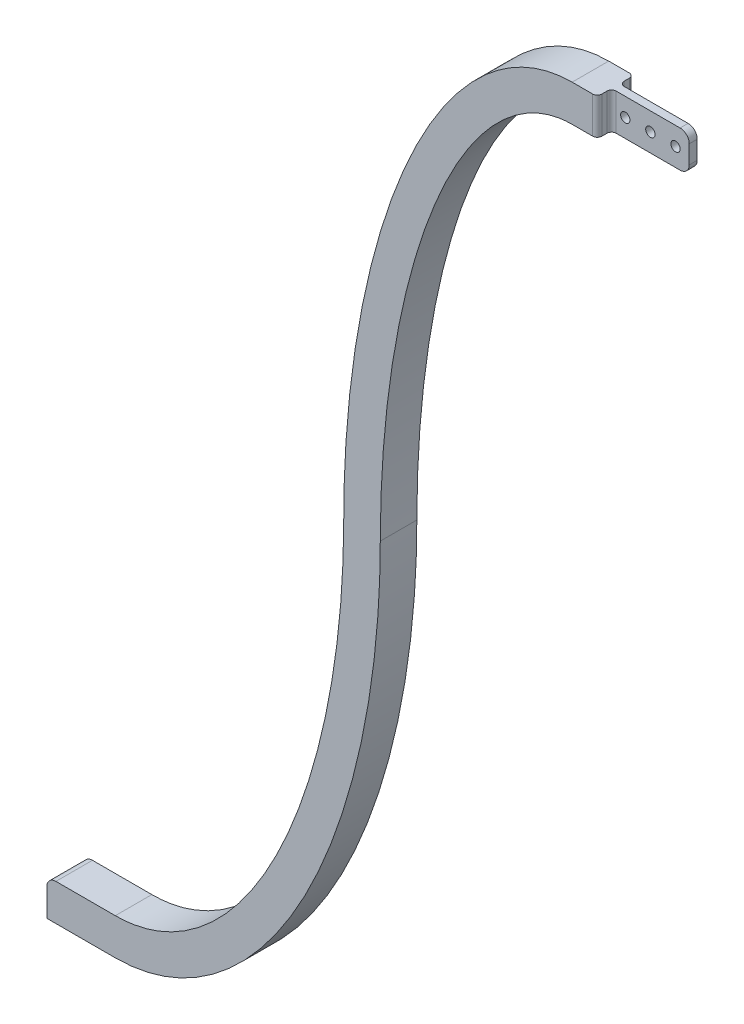
from build123d import *

# Parameters (mm, degrees)
BOSS_EXTRUDE1_DEPTH = 4
SKETCH2_R           = 1.025
CUT_EXTRUDE1_DEPTH  = 131.32363576
FILLET1_R           = 2
SKETCH3_W           = 17
SKETCH3_H           = 8
CUT_EXTRUDE2_DEPTH  = 3.125
FILLET7_R           = 1


with BuildPart() as part:
    # Sketch1 → Boss-Extrude1 (new, symmetric)
    with BuildSketch(Plane.XY):
        with BuildLine():
            add(Edge.make_bspline(
                [(-50, -100), (0, -100), (0, 0)],
                knots=[3.141592654, 3.141592654, 3.141592654, 4.71238898, 4.71238898, 4.71238898], degree=2, weights=[1, 0.707106781, 1]))
            Line((-50, -100), (-65, -100))
            Line((-65, -100), (-65, -108))
            Line((-65, -108), (-50, -108))
            add(Edge.make_bspline(
                [(-50, -108), (8, -108), (8, 0)],
                knots=[0, 0, 0, 1.570796327, 1.570796327, 1.570796327], degree=2, weights=[1, 0.707106781, 1]))
            add(Edge.make_bspline(
                [(50, 100), (8, 100), (8, 0)],
                knots=[0, 0, 0, 1.570796327, 1.570796327, 1.570796327], degree=2, weights=[1, 0.707106781, 1]))
            Line((50, 100), (72.5, 100))
            Line((72.5, 100), (72.5, 108))
            Line((72.5, 108), (50, 108))
            add(Edge.make_bspline(
                [(50, 108), (0, 108), (0, 0)],
                knots=[3.141592654, 3.141592654, 3.141592654, 4.71238898, 4.71238898, 4.71238898], degree=2, weights=[1, 0.707106781, 1]))
        make_face()
    extrude(amount=BOSS_EXTRUDE1_DEPTH, both=True)

    # Sketch2 → Cut-Extrude1 (cut, through all)
    with BuildSketch(Plane.XY.offset(4)):
        with Locations((69.5, 104)):
            Circle(SKETCH2_R)
        with Locations((64, 104)):
            Circle(SKETCH2_R)
        with Locations((58.5, 104)):
            Circle(SKETCH2_R)
    extrude(amount=-CUT_EXTRUDE1_DEPTH, mode=Mode.SUBTRACT)

    # Fillet1
    fillet1_edges = [part.edges().sort_by_distance(p)[0] for p in [
        (72.5, 100, 0),
        (-65, -100, 0),
        (72.5, 108, 0),
    ]]
    fillet(fillet1_edges, radius=FILLET1_R)

    # Sketch3 → Cut-Extrude2 (cut)
    with BuildSketch(Plane.XY.offset(4)):
        with Locations((64, 104)):
            Rectangle(SKETCH3_W, SKETCH3_H)
    cut_extrude2 = extrude(amount=-CUT_EXTRUDE2_DEPTH, mode=Mode.SUBTRACT)

    # Mirror1: Cut-Extrude2 across plane
    add(cut_extrude2.mirror(Plane.XY), mode=Mode.SUBTRACT)

    # Fillet7
    fillet7_edges = [part.edges().sort_by_distance(p)[0] for p in [
        (55.5, 104, -0.875),
        (55.5, 104, -4),
        (55.5, 104, 4),
        (55.5, 104, 0.875),
    ]]
    fillet(fillet7_edges, radius=FILLET7_R)


solid = part.part
